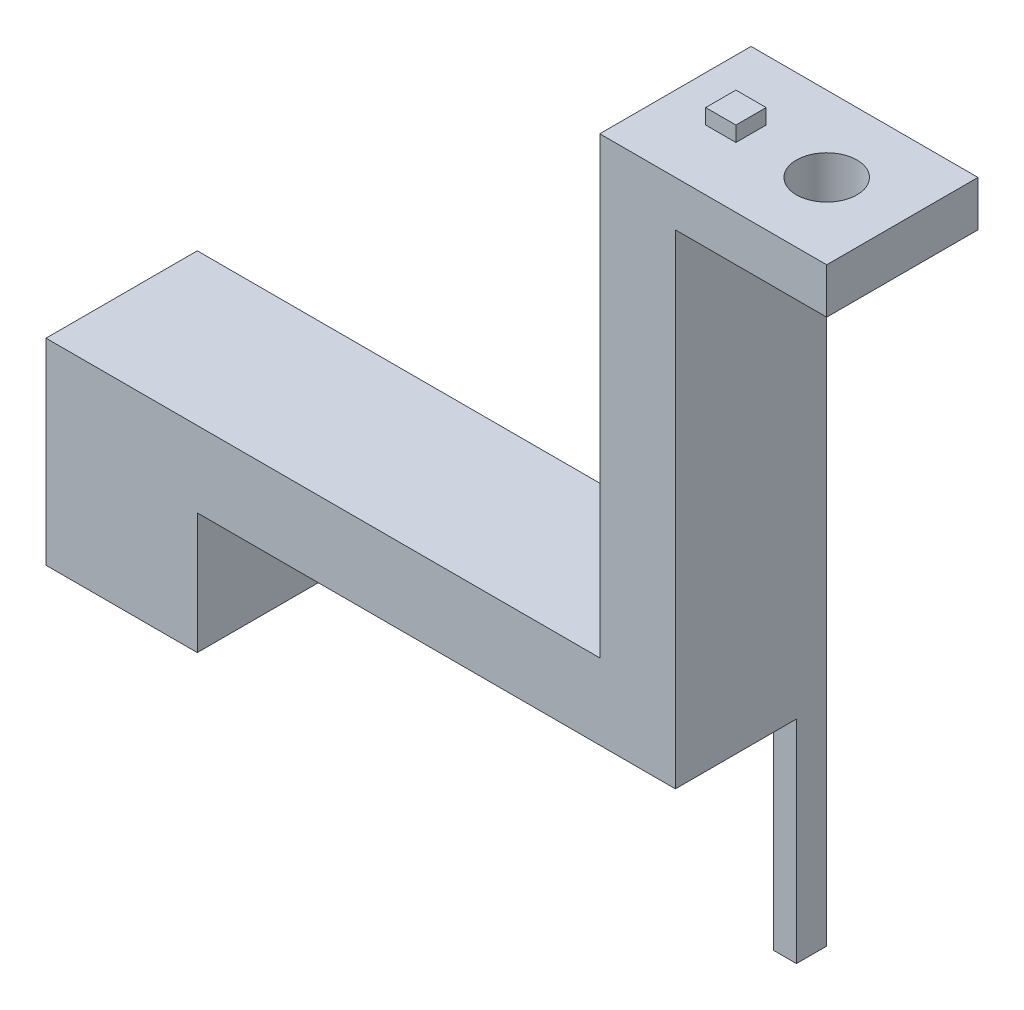
from build123d import *

# Parameters (mm, degrees)
BOSS_EXTRUDE1_DEPTH = 10
SKETCH2_W           = 5.1
SKETCH2_H           = 3.1
CUT_EXTRUDE1_DEPTH  = 10
SKETCH3_W           = 2
SKETCH3_H           = 2
BOSS_EXTRUDE2_DEPTH = 1
CUT_EXTRUDE4_REACH  = 69.908
SKETCH11_R          = 2
SKETCH12_W          = 1.5
SKETCH12_H          = 2
BOSS_EXTRUDE4_DEPTH = 14


with BuildPart() as part:
    # Sketch1 → Boss-Extrude1 (new body)
    with BuildSketch(Plane.XY):
        Polygon((10, 13), (36.6, 13), (36.6, 43), (51.6, 43), (51.6, 40), (41.6, 40), (41.6, 8), (10, 8), (10, 0), (0, 0), (0, 13), align=None)
    extrude(amount=BOSS_EXTRUDE1_DEPTH)

    # Sketch2 → Cut-Extrude1 (cut)
    with BuildSketch(Plane.XZ):
        with Locations((5, 5)):
            Rectangle(SKETCH2_W, SKETCH2_H)
    extrude(amount=-CUT_EXTRUDE1_DEPTH, mode=Mode.SUBTRACT)

    # Sketch3 → Boss-Extrude2 (add)
    with BuildSketch(Plane(origin=(0, 43, 0), x_dir=(1, 0, 0), z_dir=(0, 1, 0))):
        with Locations((40.6, -5)):
            Rectangle(SKETCH3_W, SKETCH3_H)
    extrude(amount=BOSS_EXTRUDE2_DEPTH)

    # Sketch11 → Cut-Extrude4 (cut, up to next)
    with BuildSketch(Plane(origin=(0, 43, 0), x_dir=(1, 0, 0), z_dir=(0, 1, 0)), mode=Mode.PRIVATE) as cut_extrude4_sk1:
        with Locations(Location((46.6, -5, 0), (0, 0, 270))):
            Circle(SKETCH11_R)
    cut_extrude4_tool1 = extrude(cut_extrude4_sk1.sketch, amount=-CUT_EXTRUDE4_REACH, mode=Mode.PRIVATE) & part.part
    add(cut_extrude4_tool1.solids().sort_by_distance((46.6, 43, 5))[0], mode=Mode.SUBTRACT)

    # Sketch12 → Boss-Extrude4 (add)
    with BuildSketch(Plane.XZ.offset(-8)):
        with Locations((40.85, 1)):
            Rectangle(SKETCH12_W, SKETCH12_H)
    extrude(amount=BOSS_EXTRUDE4_DEPTH)


solid = part.part
